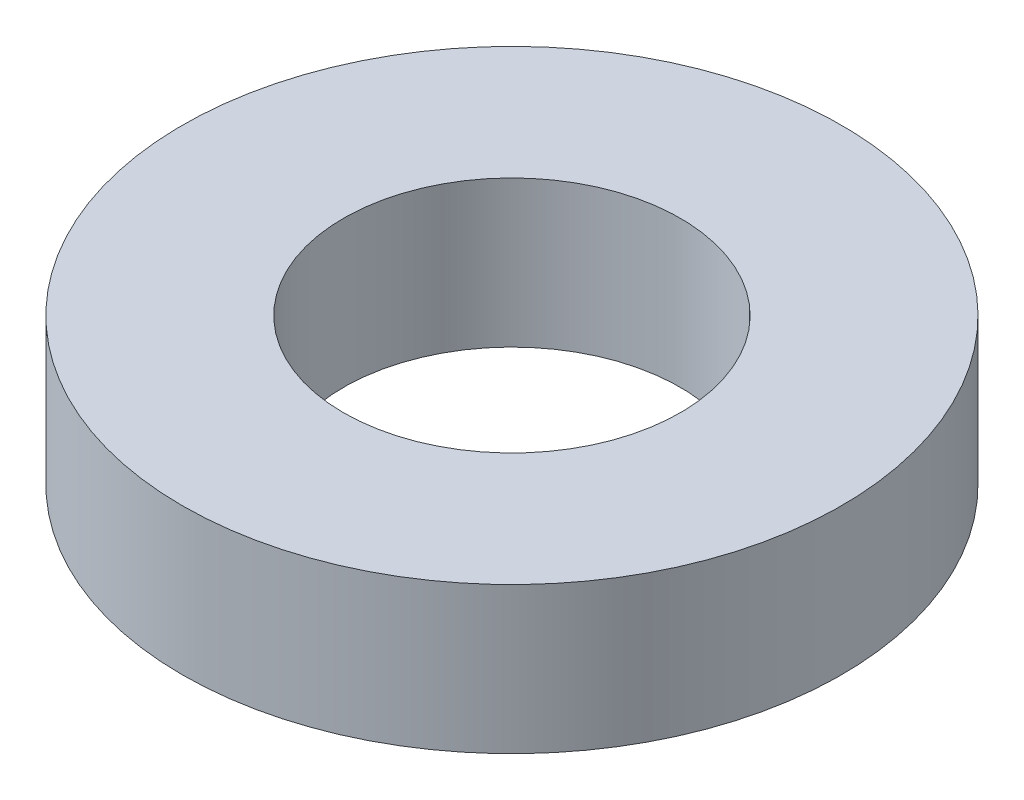
from build123d import *

# Parameters (mm, degrees)
SKETCH1_R           = 2.25
SKETCH1_R_2         = 1.15
BOSS_EXTRUDE1_DEPTH = 1


with BuildPart() as part:
    # Sketch1 → Boss-Extrude1 (new body)
    with BuildSketch(Plane(origin=(0, 0, 0), x_dir=(1, 0, 0), z_dir=(0, 1, 0))):
        with Locations(Location((0, 0, 0), (0, 0, 270))):
            Circle(SKETCH1_R)
        with Locations(Location((0, 0, 0), (0, 0, 270))):
            Circle(SKETCH1_R_2, mode=Mode.SUBTRACT)
    extrude(amount=BOSS_EXTRUDE1_DEPTH)


solid = part.part
